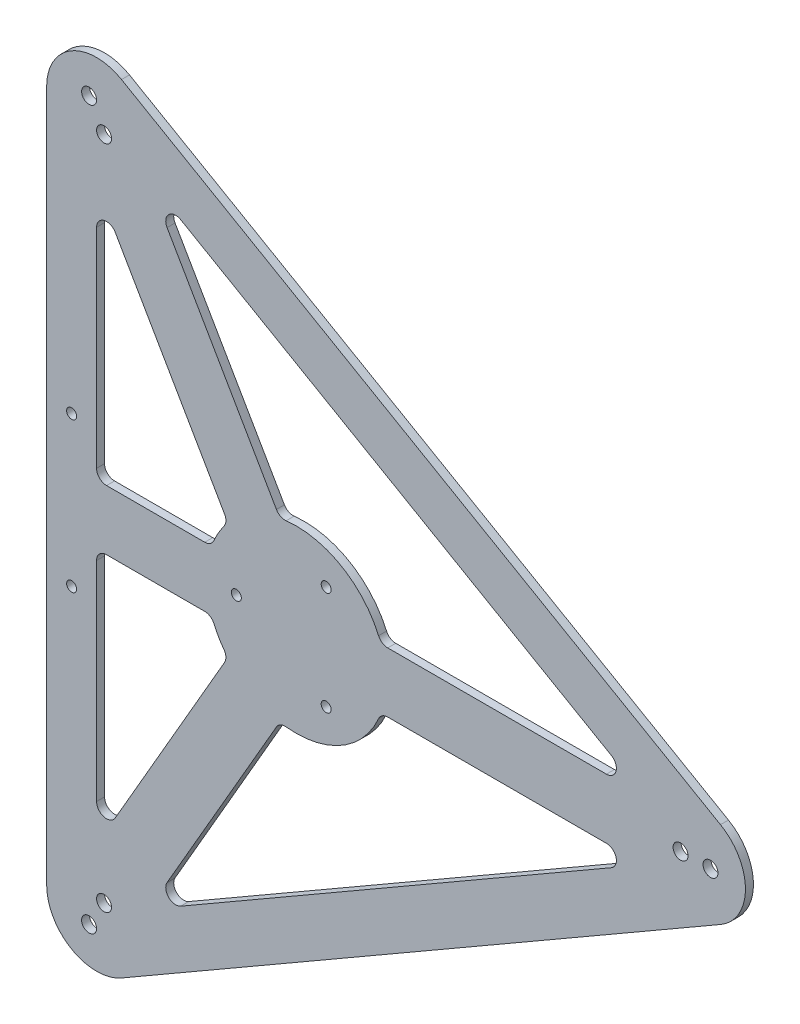
from build123d import *

# Parameters (mm, degrees)
BOARD_DEPTH     = 0.8
CUT_DEPTH       = 60.975412975
HOLESSKE_R      = 0.5
HOLES_DEPTH     = 60.975412975
HOLES2SKE_R     = 0.75
HOLES2_DEPTH    = 60.975412975
HOLES3SKE_R     = 0.5
HOLES3_DEPTH    = 60.975412975
REINFORCE_START = 0.8
REINFORCE_DEPTH = 0.8


with BuildPart() as part:
    # BoardSke → Board (new body)
    with BuildSketch(Plane.XY):
        with BuildLine():
            Line((42.5, 4.330127019), (-17.5, 38.97114317))
            ThreePointArc((-17.5, 38.97114317), (-22.5, 38.97114317), (-25, 34.641016151))
            Line((-25, 34.641016151), (-25, -34.641016151))
            ThreePointArc((-25, -34.641016151), (-22.5, -38.97114317), (-17.5, -38.97114317))
            Line((-17.5, -38.97114317), (42.5, -4.330127019))
            ThreePointArc((42.5, -4.330127019), (45, 0), (42.5, 4.330127019))
        make_face()
    extrude(amount=BOARD_DEPTH)

    # CutSke → Cut (cut, through all)
    with BuildSketch(Plane.XY.offset(0.8)):
        with BuildLine():
            Line((31.07179677, 3), (9.16515139, 3))
            ThreePointArc((9.16515139, 3), (8.617428832, 3.163339973), (8.248636251, 3.6))
            ThreePointArc((8.248636251, 3.6), (4.5, 7.794228634), (-1.006626672, 8.94352854))
            ThreePointArc((-1.006626672, 8.94352854), (-1.569181638, 9.044582271), (-1.984499484, 9.437253933))
            Line((-1.984499484, 9.437253933), (-12.937822174, 28.408965344))
            ThreePointArc((-12.937822174, 28.408965344), (-12.778903551, 29.616072125), (-11.57179677, 29.774990748))
            Line((-11.57179677, 29.774990748), (31.57179677, 4.866025404))
            ThreePointArc((31.57179677, 4.866025404), (32.037722596, 3.741180955), (31.07179677, 3))
        make_face()
        with BuildLine():
            Line((31.07179677, -3), (9.16515139, -3))
            ThreePointArc((9.16515139, -3), (8.617428832, -3.163339973), (8.248636251, -3.6))
            ThreePointArc((8.248636251, -3.6), (4.5, -7.794228634), (-1.006626672, -8.94352854))
            ThreePointArc((-1.006626672, -8.94352854), (-1.569181638, -9.044582271), (-1.984499484, -9.437253933))
            Line((-1.984499484, -9.437253933), (-12.937822174, -28.408965344))
            ThreePointArc((-12.937822174, -28.408965344), (-12.778903551, -29.616072125), (-11.57179677, -29.774990748))
            Line((-11.57179677, -29.774990748), (31.57179677, -4.866025404))
            ThreePointArc((31.57179677, -4.866025404), (32.037722596, -3.741180955), (31.07179677, -3))
        make_face()
        with BuildLine():
            Line((-18.133974596, -25.408965344), (-7.180651906, -6.437253933))
            ThreePointArc((-7.180651906, -6.437253933), (-7.048247194, -5.881242297), (-7.242009579, -5.34352854))
            ThreePointArc((-7.242009579, -5.34352854), (-9, 0), (-7.242009579, 5.34352854))
            ThreePointArc((-7.242009579, 5.34352854), (-7.048247194, 5.881242297), (-7.180651906, 6.437253933))
            Line((-7.180651906, 6.437253933), (-18.133974596, 25.408965344))
            ThreePointArc((-18.133974596, 25.408965344), (-19.258819045, 25.87489117), (-20, 24.908965344))
            Line((-20, 24.908965344), (-20, -24.908965344))
            ThreePointArc((-20, -24.908965344), (-19.258819045, -25.87489117), (-18.133974596, -25.408965344))
        make_face()
    extrude(amount=-CUT_DEPTH, mode=Mode.SUBTRACT)

    # HolesSke → Holes (cut, through all)
    with BuildSketch(Plane.XY.offset(0.8)):
        with Locations((-6, 0)):
            Circle(HOLESSKE_R)
        with Locations((3, 5.196152423)):
            Circle(HOLESSKE_R)
        with Locations((3, -5.196152423)):
            Circle(HOLESSKE_R)
    extrude(amount=-HOLES_DEPTH, mode=Mode.SUBTRACT)

    # Holes2Ske → Holes2 (cut, through all)
    with BuildSketch(Plane.XY.offset(0.8)):
        with Locations((38.5, 0)):
            Circle(HOLES2SKE_R)
        with Locations((41.5, 0)):
            Circle(HOLES2SKE_R)
        with Locations((-19.25, -33.341978046)):
            Circle(HOLES2SKE_R)
        with Locations((-20.75, -35.940054257)):
            Circle(HOLES2SKE_R)
        with Locations((-19.25, 33.341978046)):
            Circle(HOLES2SKE_R)
        with Locations((-20.75, 35.940054257)):
            Circle(HOLES2SKE_R)
    extrude(amount=-HOLES2_DEPTH, mode=Mode.SUBTRACT)

    # Holes3Ske → Holes3 (cut, through all)
    with BuildSketch(Plane.XY.offset(0.8)):
        with Locations((-22.5, 7.5)):
            Circle(HOLES3SKE_R)
        with Locations((-22.5, -7.5)):
            Circle(HOLES3SKE_R)
    extrude(amount=-HOLES3_DEPTH, mode=Mode.SUBTRACT)

    # ReinforceSke → Reinforce (add)
    with BuildSketch(Plane.XY.offset(REINFORCE_START)):
        with BuildLine():
            Line((-9.16515139, 3), (-19, 3))
            ThreePointArc((-19, 3), (-19.707106781, 3.292893219), (-20, 4))
            Line((-20, 4), (-20, -4))
            ThreePointArc((-20, -4), (-19.707106781, -3.292893219), (-19, -3))
            Line((-19, -3), (-9.16515139, -3))
            ThreePointArc((-9.16515139, -3), (-8.617428832, -3.163339973), (-8.248636251, -3.6))
            ThreePointArc((-8.248636251, -3.6), (-9, 0), (-8.248636251, 3.6))
            ThreePointArc((-8.248636251, 3.6), (-8.617428832, 3.163339973), (-9.16515139, 3))
        make_face()
    extrude(amount=-REINFORCE_DEPTH)


solid = part.part
